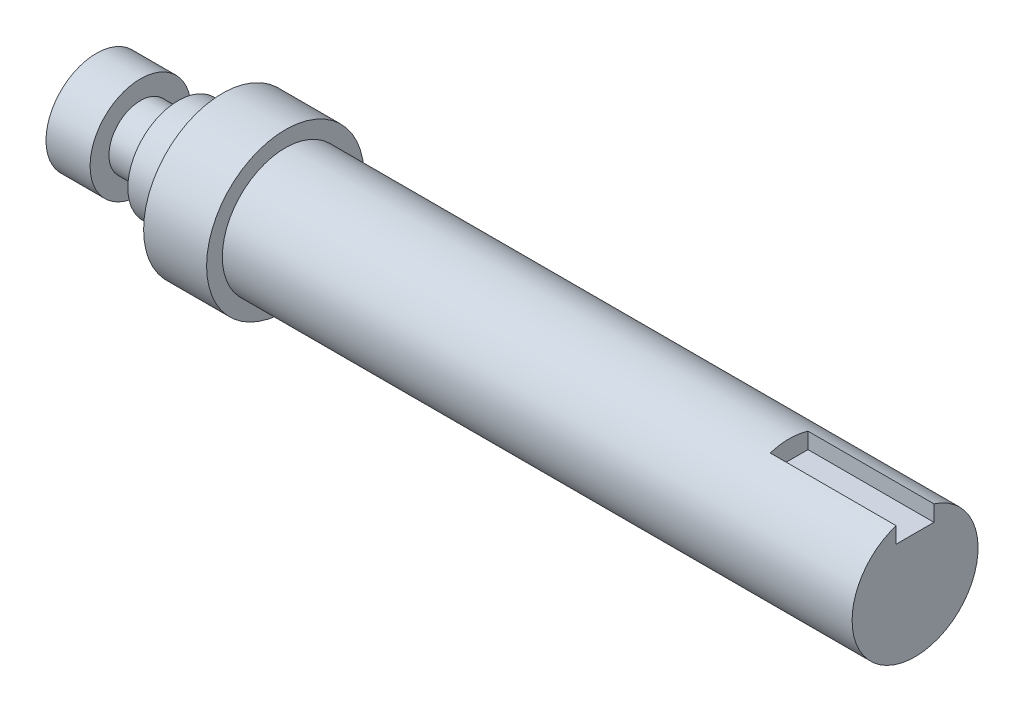
from build123d import *

# Parameters (mm, degrees)
CUT_EXTRUDE1_DEPTH = 20


with BuildPart() as part:
    # Sketch1 → Revolve1 (revolve)
    with BuildSketch(Plane.XY, mode=Mode.PRIVATE) as revolve1_sk:
        Polygon((-65, 0), (-65, 8), (-58, 8), (-58, 5), (-52, 5), (-52, 8), (-45, 8), (-45, 12.5), (-35, 12.5), (-35, 10), (65, 10), (65, 0), align=None)
    revolve(revolve1_sk.sketch.rotate(Axis((-30.426229508, 0, 0), (1, 0, 0)), 90), axis=Axis((-30.426229508, 0, 0), (1, 0, 0)))

    # Sketch2 → Cut-Extrude1 (cut)
    with BuildSketch(Plane(origin=(65, 0, 0), x_dir=(0, 0, -1), z_dir=(1, 0, 0))):
        with BuildLine():
            Line((-3, 9.539392014), (-3, 7))
            Line((-3, 7), (3, 7))
            Line((3, 7), (3, 9.539392014))
            ThreePointArc((3, 9.539392014), (0, 10), (-3, 9.539392014))
        make_face()
    extrude(amount=-CUT_EXTRUDE1_DEPTH, mode=Mode.SUBTRACT)


solid = part.part
